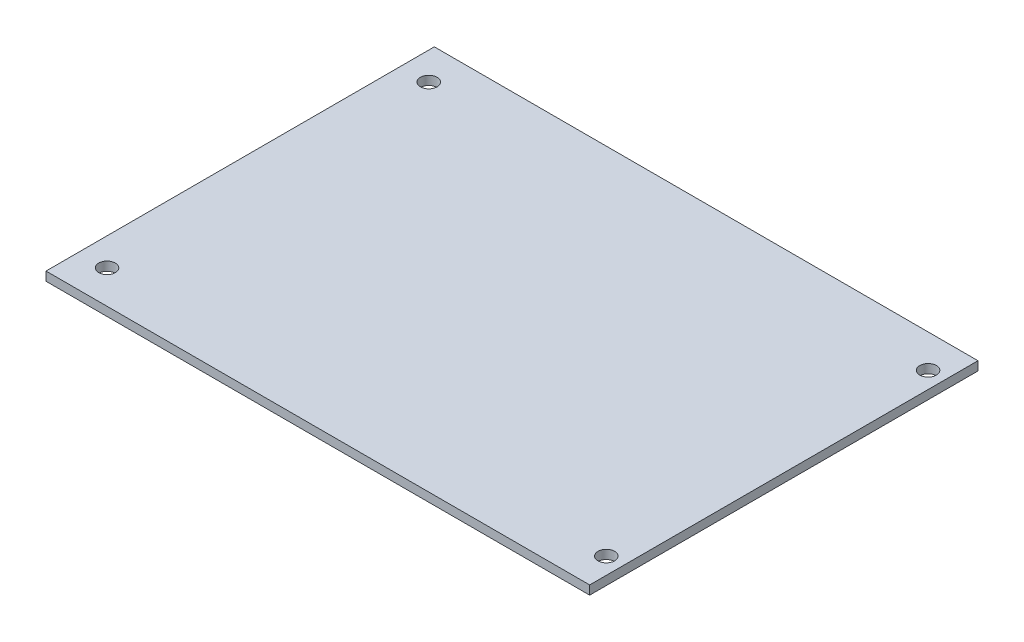
from build123d import *

# Parameters (mm, degrees)
SKETCH_1_W      = 98
SKETCH_1_H      = 70
SKETCH_1_R      = 1.5
EXTRUDE_1_DEPTH = 1.6


with BuildPart() as part:
    # Эскиз1 → Бобышка-Вытянуть1 (new body)
    with BuildSketch(Plane(origin=(0, 0, 0), x_dir=(1, 0, 0), z_dir=(0, 1, 0))):
        Rectangle(SKETCH_1_W, SKETCH_1_H)
        with Locations(Location((-44, 29, 0), (0, 0, 270))):
            Circle(SKETCH_1_R, mode=Mode.SUBTRACT)
        with Locations(Location((-44, -29, 0), (0, 0, 90))):
            Circle(SKETCH_1_R, mode=Mode.SUBTRACT)
        with Locations(Location((46, 29, 0), (0, 0, 270))):
            Circle(SKETCH_1_R, mode=Mode.SUBTRACT)
        with Locations(Location((46, -29, 0), (0, 0, 90))):
            Circle(SKETCH_1_R, mode=Mode.SUBTRACT)
    extrude(amount=EXTRUDE_1_DEPTH)


solid = part.part
